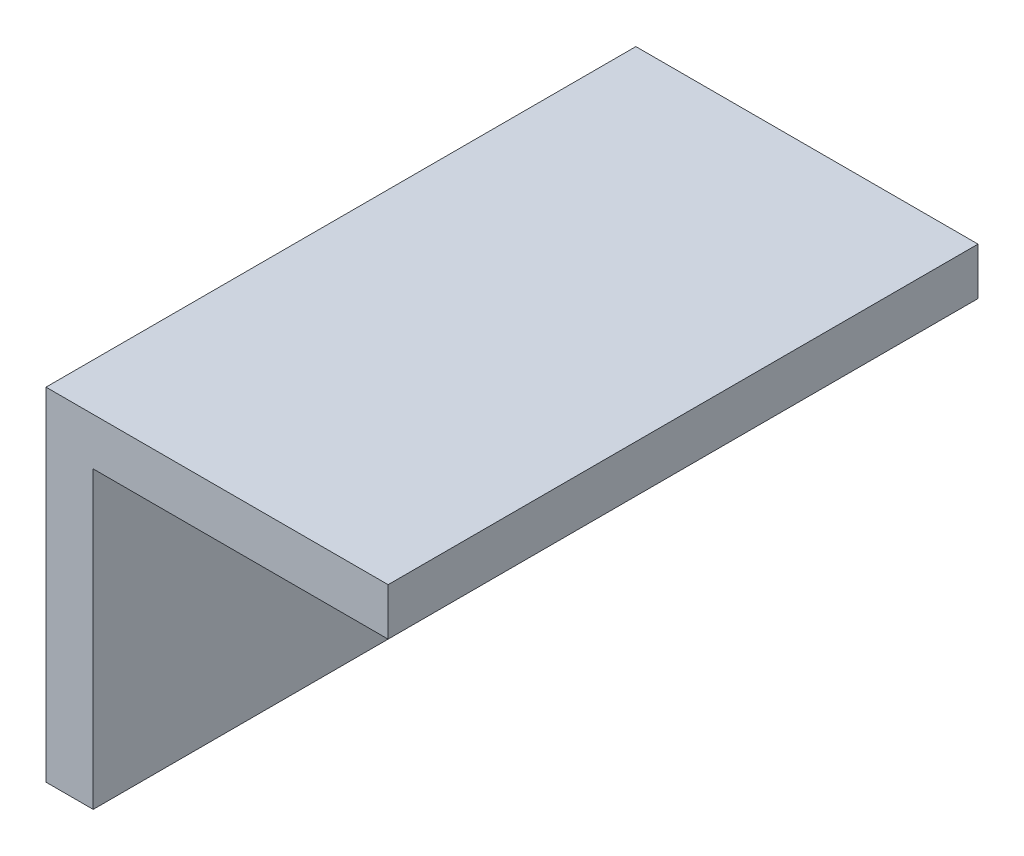
from build123d import *

# Parameters (mm, degrees)
BOSS_EXTRUDE1_DEPTH = 50


with BuildPart() as part:
    # Sketch1 → Boss-Extrude1 (new, symmetric)
    with BuildSketch(Plane.XY):
        Polygon((0, 0), (50, 0), (50, 8), (-8, 8), (-8, -50), (0, -50), align=None)
    extrude(amount=BOSS_EXTRUDE1_DEPTH, both=True)


solid = part.part
